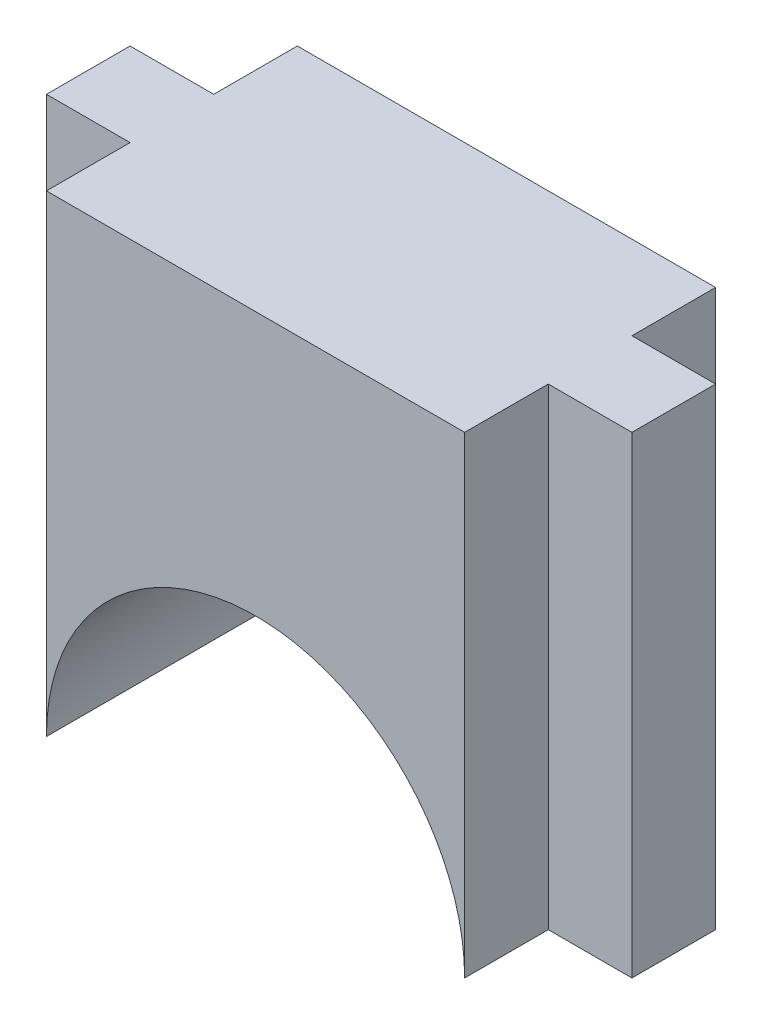
from build123d import *

# Parameters (mm, degrees)
EXTRUDE1_DEPTH = 9
SKETCH2_W      = 3
SKETCH2_H      = 16.95
EXTRUDE2_DEPTH = 3


with BuildPart() as part:
    # Sketch1 → Extrude1 (new body)
    with BuildSketch(Plane.XY):
        with BuildLine():
            Line((7.5, 0), (7.5, 16.95))
            Line((7.5, 16.95), (-7.5, 16.95))
            Line((-7.5, 16.95), (-7.5, 0))
            ThreePointArc((-7.5, 0), (0, 7.5), (7.5, 0))
        make_face()
    extrude(amount=EXTRUDE1_DEPTH)

    # Sketch2 → Extrude2 (add)
    with BuildSketch(Plane(origin=(7.5, 0, 0), x_dir=(0, 0, -1), z_dir=(1, 0, 0))):
        with Locations((-4.5, 8.475)):
            Rectangle(SKETCH2_W, SKETCH2_H)
    extrude2 = extrude(amount=EXTRUDE2_DEPTH)

    # Mirror1: Extrude2 across plane
    add(extrude2.mirror(Plane.ZY))


solid = part.part
